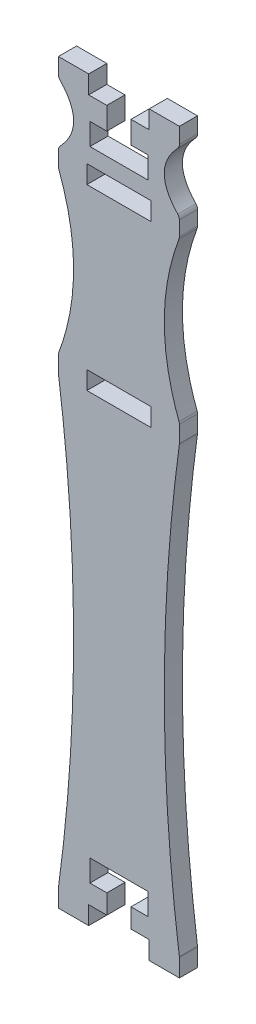
from build123d import *

# Parameters (mm, degrees)
CROQUIS1_W              = 10
CROQUIS1_H              = 3
SALIENTE_EXTRUIR1_DEPTH = 3
CROQUIS2_W              = 0.3
CROQUIS2_H              = 0.3
CROQUIS2_H_2            = 3
CORTAR_EXTRUIR2_DEPTH   = 3


with BuildPart() as part:
    # Croquis1 → Saliente-Extruir1 (new body)
    with BuildSketch(Plane.XY):
        with BuildLine():
            Line((-10, 70), (-10, 67))
            Line((-10, 67), (-7, 67))
            Line((-7, 67), (-7, 63))
            Line((-7, 63), (-9.5, 63))
            Line((-9.5, 63), (-9.5, 60))
            Line((-9.5, 60), (-0.5, 60))
            Line((-0.5, 60), (-0.5, 63))
            Line((-0.5, 63), (-3, 63))
            Line((-3, 63), (-3, 67))
            Line((-3, 67), (0, 67))
            Line((0, 67), (0, 70))
            Line((0, 70), (5, 70))
            Line((5, 70), (5, 67.405747627))
            ThreePointArc((5, 67.405747627), (4.929306729, 67.036438809), (4.727221995, 66.719345288))
            add(Edge.make_bspline(
                [(4.727221995, 66.719345288), (3.242407332, 65.146230192), (1.757592668, 62), (3.242407332, 58.853769808), (4.727221995, 57.280654712)],
                knots=[0.028065471, 0.028065471, 0.028065471, 0.028065471, 0.5, 0.971934529, 0.971934529, 0.971934529, 0.971934529], degree=3))
            ThreePointArc((4.727221995, 57.280654712), (4.929306729, 56.963561191), (5, 56.594252373))
            Line((5, 56.594252373), (5, 54.181314171))
            ThreePointArc((5, 54.181314171), (4.9841425, 54.003934523), (4.937072921, 53.832180471))
            add(Edge.make_bspline(
                [(4.937072921, 53.832180471), (3.31235764, 49.471453647), (1.68764236, 40.75), (3.31235764, 32.028546353), (4.937072921, 27.667819529)],
                knots=[0.006332812, 0.006332812, 0.006332812, 0.006332812, 0.5, 0.993667188, 0.993667188, 0.993667188, 0.993667188], degree=3))
            ThreePointArc((4.937072921, 27.667819529), (4.9841425, 27.496065477), (5, 27.318685829))
            Line((5, 27.318685829), (5, 24.567654138))
            ThreePointArc((5, 24.567654138), (4.997723384, 24.500214919), (4.990903903, 24.433082766))
            add(Edge.make_bspline(
                [(4.990903903, -48.933082766), (3.330301301, -36.70538851), (1.669698699, -12.25), (3.330301301, 12.20538851), (4.990903903, 24.433082766)],
                knots=[0.000910439, 0.000910439, 0.000910439, 0.000910439, 0.5, 0.999089561, 0.999089561, 0.999089561, 0.999089561], degree=3))
            ThreePointArc((4.990903903, -48.933082766), (4.997723384, -49.000214919), (5, -49.067654138))
            Line((5, -49.067654138), (5, -51.701381229))
            Line((5, -51.701381229), (5, -52))
            Line((5, -52), (0, -52))
            Line((0, -52), (0, -49))
            Line((0, -49), (-3, -49))
            Line((-3, -49), (-3, -45.5))
            Line((-3, -45.5), (-0.5, -45.5))
            Line((-0.5, -45.5), (-0.5, -42.5))
            Line((-0.5, -42.5), (-9.5, -42.5))
            Line((-9.5, -42.5), (-9.5, -45.5))
            Line((-9.5, -45.5), (-7, -45.5))
            Line((-7, -45.5), (-7, -49))
            Line((-7, -49), (-10, -49))
            Line((-10, -49), (-10, -52))
            Line((-10, -52), (-15, -52))
            Line((-15, -52), (-15, -51.701381229))
            Line((-15, -51.701381229), (-15, -49.067654138))
            ThreePointArc((-15, -49.067654138), (-14.997723384, -49.000214919), (-14.990903903, -48.933082766))
            add(Edge.make_bspline(
                [(-14.990903903, -48.933082766), (-13.330301301, -36.70538851), (-11.669698699, -12.25), (-13.330301301, 12.20538851), (-14.990903903, 24.433082766)],
                knots=[0.000910439, 0.000910439, 0.000910439, 0.000910439, 0.5, 0.999089561, 0.999089561, 0.999089561, 0.999089561], degree=3))
            ThreePointArc((-14.990903903, 24.433082766), (-14.997723384, 24.500214919), (-15, 24.567654138))
            Line((-15, 24.567654138), (-15, 27.318685829))
            ThreePointArc((-15, 27.318685829), (-14.9841425, 27.496065477), (-14.937072921, 27.667819529))
            add(Edge.make_bspline(
                [(-14.937072921, 53.832180471), (-13.31235764, 49.471453647), (-11.68764236, 40.75), (-13.31235764, 32.028546353), (-14.937072921, 27.667819529)],
                knots=[0.006332812, 0.006332812, 0.006332812, 0.006332812, 0.5, 0.993667188, 0.993667188, 0.993667188, 0.993667188], degree=3))
            ThreePointArc((-14.937072921, 53.832180471), (-14.9841425, 54.003934523), (-15, 54.181314171))
            Line((-15, 54.181314171), (-15, 56.594252373))
            ThreePointArc((-15, 56.594252373), (-14.929306729, 56.963561191), (-14.727221995, 57.280654712))
            add(Edge.make_bspline(
                [(-14.727221995, 57.280654712), (-13.242407332, 58.853769808), (-11.757592668, 62), (-13.242407332, 65.146230192), (-14.727221995, 66.719345288)],
                knots=[0.028065471, 0.028065471, 0.028065471, 0.028065471, 0.5, 0.971934529, 0.971934529, 0.971934529, 0.971934529], degree=3))
            ThreePointArc((-14.727221995, 66.719345288), (-14.929306729, 67.036438809), (-15, 67.405747627))
            Line((-15, 67.405747627), (-15, 70))
            Line((-15, 70), (-10, 70))
        make_face()
        with Locations((-5, 26)):
            Rectangle(CROQUIS1_W, CROQUIS1_H, mode=Mode.SUBTRACT)
        with Locations((-5, 55.5)):
            Rectangle(CROQUIS1_W, CROQUIS1_H, mode=Mode.SUBTRACT)
    extrude(amount=SALIENTE_EXTRUIR1_DEPTH)

    # Croquis2 → Cortar-Extruir2 (cut)
    with BuildSketch(Plane.XY.offset(3)):
        Polygon((-9.8, -45.5), (-9.8, -45.8), (-9.5, -45.8), (-7, -45.8), (-7, -45.5), (-9.5, -45.5), (-9.5, -42.5), (-0.5, -42.5), (-0.5, -42.2), (-9.5, -42.2), (-9.8, -42.2), (-9.8, -42.5), align=None)
        Polygon((-0.5, -45.8), (-0.2, -45.8), (-0.2, -45.5), (-0.2, -42.5), (-0.5, -42.5), (-0.5, -45.5), (-3, -45.5), (-3, -45.8), align=None)
        with Locations((-0.35, -42.35)):
            Rectangle(CROQUIS2_W, CROQUIS2_H)
        with Locations((-10.15, 26)):
            Rectangle(CROQUIS2_W, CROQUIS2_H_2)
        with Locations((0.15, 26)):
            Rectangle(CROQUIS2_W, CROQUIS2_H_2)
        with Locations((0.15, 55.5)):
            Rectangle(CROQUIS2_W, CROQUIS2_H_2)
        with Locations((-10.15, 55.5)):
            Rectangle(CROQUIS2_W, CROQUIS2_H_2)
        Polygon((-9.8, 63.3), (-9.5, 63.3), (-7, 63.3), (-7, 63), (-9.5, 63), (-9.5, 60), (-0.5, 60), (-0.5, 63), (-3, 63), (-3, 63.3), (-0.5, 63.3), (-0.2, 63.3), (-0.2, 63), (-0.2, 60), (-0.2, 59.7), (-0.5, 59.7), (-9.5, 59.7), (-9.8, 59.7), (-9.8, 60), (-9.8, 63), align=None)
    extrude(amount=-CORTAR_EXTRUIR2_DEPTH, mode=Mode.SUBTRACT)


solid = part.part
